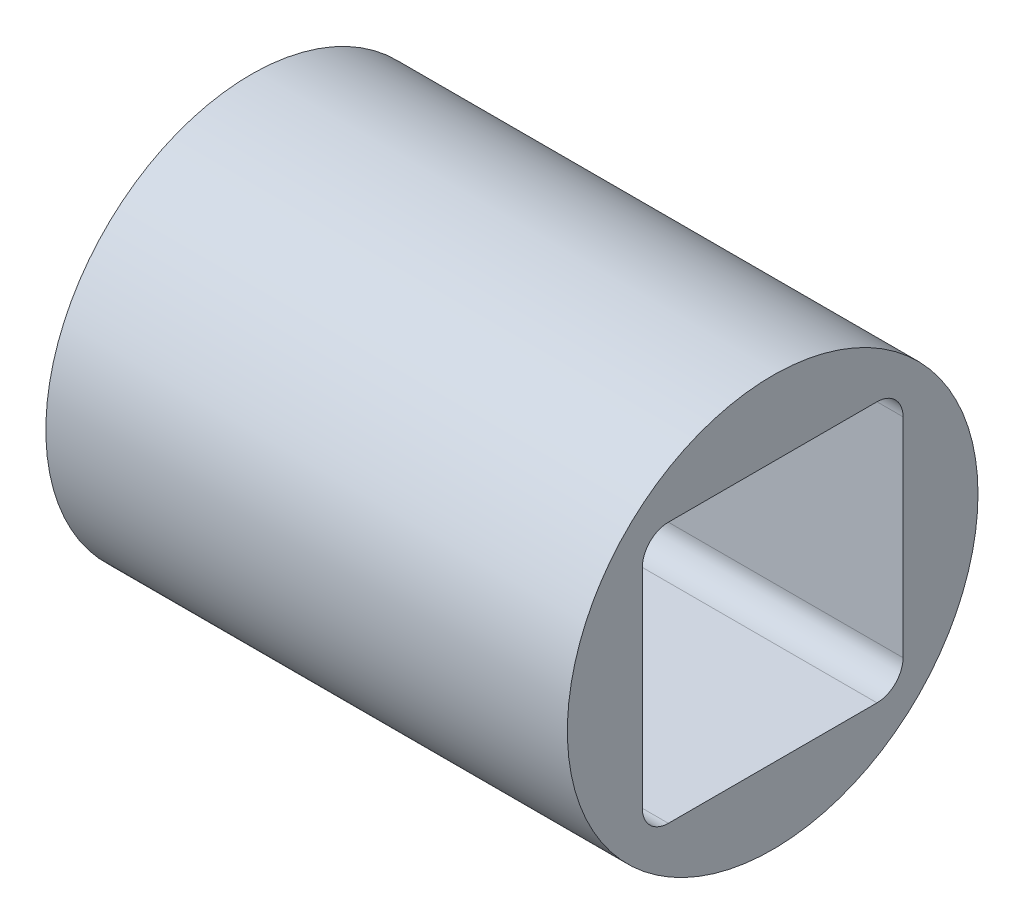
from build123d import *

# Parameters (mm, degrees)
SKETCH1_R           = 5
SKETCH1_W           = 6.35
SKETCH1_H           = 6.35
BOSS_EXTRUDE1_DEPTH = 12.7
FILLET1_R           = 0.635


with BuildPart() as part:
    # Sketch1 → Boss-Extrude1 (new body)
    with BuildSketch(Plane(origin=(0, 0, 0), x_dir=(0, 0, -1), z_dir=(1, 0, 0))):
        Circle(SKETCH1_R)
        Rectangle(SKETCH1_W, SKETCH1_H, mode=Mode.SUBTRACT)
    extrude(amount=BOSS_EXTRUDE1_DEPTH)

    # Fillet1
    fillet1_edges = [part.edges().sort_by_distance(p)[0] for p in [
        (6.35, 3.175, 3.175),
        (6.35, -3.175, 3.175),
        (6.35, -3.175, -3.175),
        (6.35, 3.175, -3.175),
    ]]
    fillet(fillet1_edges, radius=FILLET1_R)


solid = part.part
